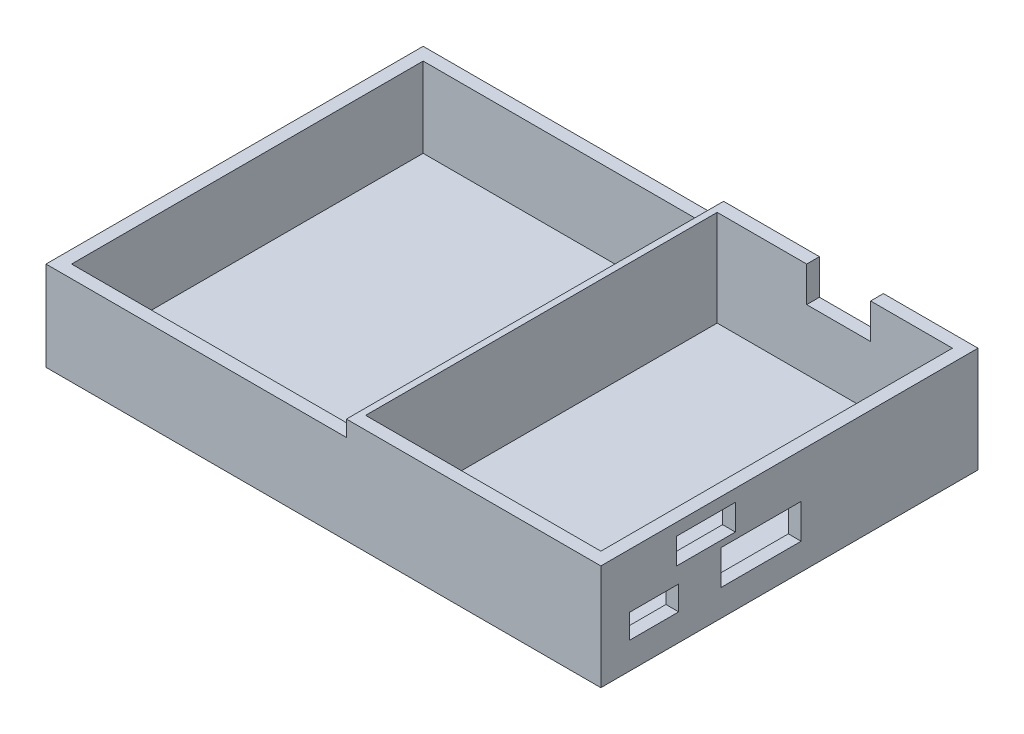
from build123d import *

# Parameters (mm, degrees)
BOSS_EXTRUDE1_DEPTH = 12.5
BOSS_EXTRUDE2_DEPTH = 15
SKETCH1_7_W         = 1
SKETCH1_7_H         = 55
BOSS_EXTRUDE3_DEPTH = 15
SKETCH1_10_W        = 86.8
SKETCH1_10_H        = 59
BOSS_EXTRUDE5_DEPTH = 1.5
SKETCH2_W           = 7.6828
SKETCH2_H           = 3.785279572
SKETCH2_W_2         = 12.5
SKETCH2_H_2         = 5.4
SKETCH2_W_3         = 9.2
SKETCH2_H_3         = 4.03174267
CUT_EXTRUDE1_DEPTH  = 10
SKETCH3_W           = 10
SKETCH3_H           = 5.5
CUT_EXTRUDE2_DEPTH  = 10


with BuildPart() as part:
    # Sketch1 → Boss-Extrude1 (new body)
    with BuildSketch(Plane(origin=(0, 0, 0), x_dir=(1, 0, 0), z_dir=(0, 1, 0))):
        Polygon((22.5, -29.5), (22.5, -27.5), (-22.5, -27.5), (-22.5, 27.5), (22.5, 27.5), (22.5, 29.5), (-24.5, 29.5), (-24.5, -29.5), align=None)
    extrude(amount=BOSS_EXTRUDE1_DEPTH)

    # Sketch1<5> → Boss-Extrude2 (add)
    with BuildSketch(Plane(origin=(0, 0, 0), x_dir=(1, 0, 0), z_dir=(0, 1, 0))):
        Polygon((23.5, -27.5), (22.5, -27.5), (22.5, -29.5), (23.5, -29.5), (62.3, -29.5), (62.3, 29.5), (23.5, 29.5), (22.5, 29.5), (22.5, 27.5), (23.5, 27.5), (60.3, 27.5), (60.3, -27.5), align=None)
    extrude(amount=BOSS_EXTRUDE2_DEPTH)

    # Sketch1<7> → Boss-Extrude3 (add)
    with BuildSketch(Plane(origin=(0, 0, 0), x_dir=(1, 0, 0), z_dir=(0, 1, 0))):
        with Locations((23, 0)):
            Rectangle(SKETCH1_7_W, SKETCH1_7_H)
    extrude(amount=BOSS_EXTRUDE3_DEPTH)

    # Sketch1<10> → Boss-Extrude5 (add)
    with BuildSketch(Plane(origin=(0, 0, 0), x_dir=(1, 0, 0), z_dir=(0, 1, 0))):
        with Locations((18.9, 0)):
            Rectangle(SKETCH1_10_W, SKETCH1_10_H)
    extrude(amount=-BOSS_EXTRUDE5_DEPTH)

    # Sketch2 → Cut-Extrude1 (cut)
    with BuildSketch(Plane(origin=(62.3, 0, 0), x_dir=(0, 0, -1), z_dir=(1, 0, 0))):
        with Locations((-21.1586, 4.57741645)):
            Rectangle(SKETCH2_W, SKETCH2_H)
        with Locations((-4.4202, 5.380056236)):
            Rectangle(SKETCH2_W_2, SKETCH2_H_2)
        with Locations((-13.060208334, 11.084128665)):
            Rectangle(SKETCH2_W_3, SKETCH2_H_3)
    extrude(amount=-CUT_EXTRUDE1_DEPTH, mode=Mode.SUBTRACT)

    # Sketch3 → Cut-Extrude2 (cut)
    with BuildSketch(Plane(origin=(0, 0, -29.5), x_dir=(-1, 0, 0), z_dir=(0, 0, -1))):
        with Locations((-42.5, 12.25)):
            Rectangle(SKETCH3_W, SKETCH3_H)
    extrude(amount=-CUT_EXTRUDE2_DEPTH, mode=Mode.SUBTRACT)


solid = part.part
